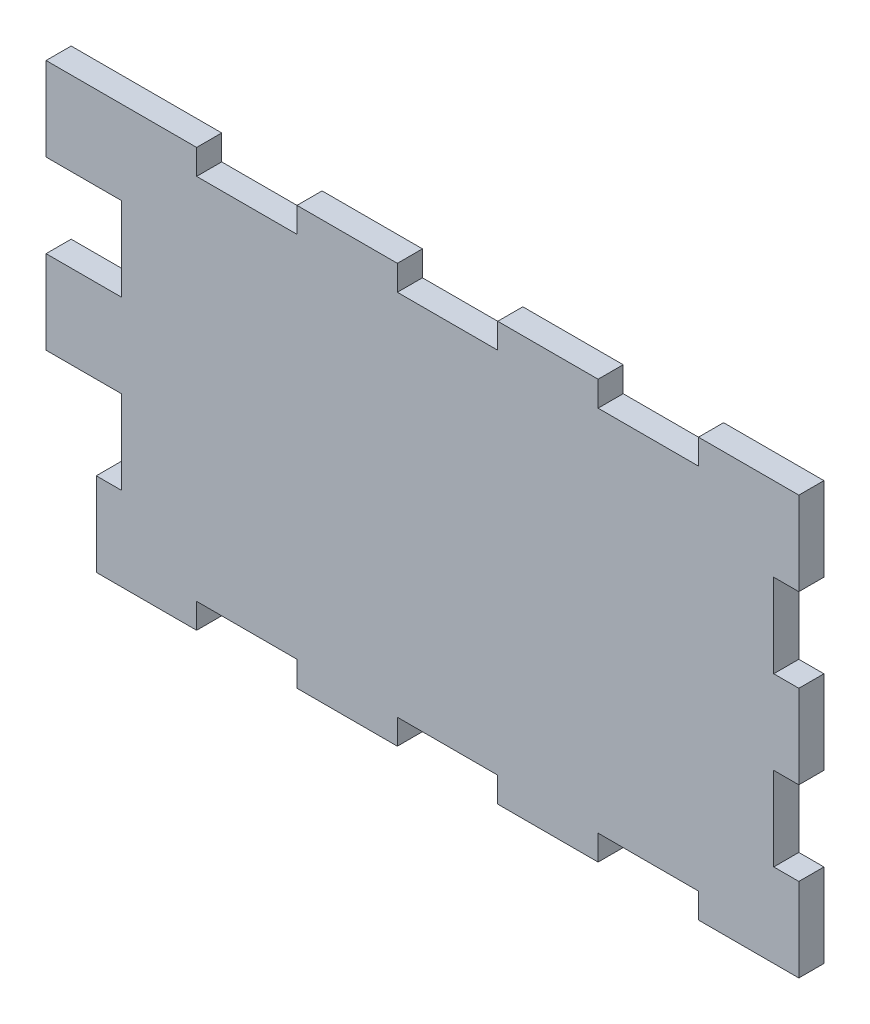
from build123d import *

# Parameters (mm, degrees)
ESBO_O4_W                = 84
ESBO_O4_H                = 50
RESSALTO_EXTRUS_O2_DEPTH = 3
CORTE_EXTRUS_O2_REACH    = 50.969
ESBO_O5_W                = 12
ESBO_O5_H                = 3
CORTE_EXTRUS_O4_REACH    = 50.969
ESBO_O6_W                = 3
ESBO_O6_H                = 10
ESBO_O11_W               = 3
ESBO_O11_H               = 10
RESSALTO_EXTRUS_O4_DEPTH = 6


with BuildPart() as part:
    # Esboço4 → Ressalto-extrusão2 (new body)
    with BuildSketch(Plane.XY):
        Rectangle(ESBO_O4_W, ESBO_O4_H)
    extrude(amount=RESSALTO_EXTRUS_O2_DEPTH)

    # Esboço5 → Corte-extrusão2 (cut, up to next)
    with BuildSketch(Plane.XY.offset(3), mode=Mode.PRIVATE) as corte_extrus_o2_sk1:
        with Locations((24, 23.5)):
            Rectangle(ESBO_O5_W, ESBO_O5_H)
    corte_extrus_o2_tool1 = extrude(corte_extrus_o2_sk1.sketch, amount=-CORTE_EXTRUS_O2_REACH, mode=Mode.PRIVATE) & part.part
    # Esboço5 → Corte-extrusão2 (cut, up to next)
    with BuildSketch(Plane.XY.offset(3), mode=Mode.PRIVATE) as corte_extrus_o2_sk2:
        with Locations((-24, 23.5)):
            Rectangle(ESBO_O5_W, ESBO_O5_H)
    corte_extrus_o2_tool2 = extrude(corte_extrus_o2_sk2.sketch, amount=-CORTE_EXTRUS_O2_REACH, mode=Mode.PRIVATE) & part.part
    # Esboço5 → Corte-extrusão2 (cut, up to next)
    with BuildSketch(Plane.XY.offset(3), mode=Mode.PRIVATE) as corte_extrus_o2_sk3:
        with Locations((0, 23.5)):
            Rectangle(ESBO_O5_W, ESBO_O5_H)
    corte_extrus_o2_tool3 = extrude(corte_extrus_o2_sk3.sketch, amount=-CORTE_EXTRUS_O2_REACH, mode=Mode.PRIVATE) & part.part
    # Esboço5 → Corte-extrusão2 (cut, up to next)
    with BuildSketch(Plane.XY.offset(3), mode=Mode.PRIVATE) as corte_extrus_o2_sk4:
        with Locations((0, -23.5)):
            Rectangle(ESBO_O5_W, ESBO_O5_H)
    corte_extrus_o2_tool4 = extrude(corte_extrus_o2_sk4.sketch, amount=-CORTE_EXTRUS_O2_REACH, mode=Mode.PRIVATE) & part.part
    # Esboço5 → Corte-extrusão2 (cut, up to next)
    with BuildSketch(Plane.XY.offset(3), mode=Mode.PRIVATE) as corte_extrus_o2_sk5:
        with Locations((-24, -23.5)):
            Rectangle(ESBO_O5_W, ESBO_O5_H)
    corte_extrus_o2_tool5 = extrude(corte_extrus_o2_sk5.sketch, amount=-CORTE_EXTRUS_O2_REACH, mode=Mode.PRIVATE) & part.part
    # Esboço5 → Corte-extrusão2 (cut, up to next)
    with BuildSketch(Plane.XY.offset(3), mode=Mode.PRIVATE) as corte_extrus_o2_sk6:
        with Locations((24, -23.5)):
            Rectangle(ESBO_O5_W, ESBO_O5_H)
    corte_extrus_o2_tool6 = extrude(corte_extrus_o2_sk6.sketch, amount=-CORTE_EXTRUS_O2_REACH, mode=Mode.PRIVATE) & part.part
    add(corte_extrus_o2_tool1.solids().sort_by_distance((24, 23.5, 3))[0], mode=Mode.SUBTRACT)
    add(corte_extrus_o2_tool2.solids().sort_by_distance((-24, 23.5, 3))[0], mode=Mode.SUBTRACT)
    add(corte_extrus_o2_tool3.solids().sort_by_distance((0, 23.5, 3))[0], mode=Mode.SUBTRACT)
    add(corte_extrus_o2_tool4.solids().sort_by_distance((0, -23.5, 3))[0], mode=Mode.SUBTRACT)
    add(corte_extrus_o2_tool5.solids().sort_by_distance((-24, -23.5, 3))[0], mode=Mode.SUBTRACT)
    add(corte_extrus_o2_tool6.solids().sort_by_distance((24, -23.5, 3))[0], mode=Mode.SUBTRACT)

    # Esboço6 → Corte-extrusão4 (cut, up to next)
    with BuildSketch(Plane.XY, mode=Mode.PRIVATE) as corte_extrus_o4_sk1:
        with Locations((40.5, 10)):
            Rectangle(ESBO_O6_W, ESBO_O6_H)
    corte_extrus_o4_tool1 = extrude(corte_extrus_o4_sk1.sketch, amount=CORTE_EXTRUS_O4_REACH, mode=Mode.PRIVATE) & part.part
    # Esboço6 → Corte-extrusão4 (cut, up to next)
    with BuildSketch(Plane.XY, mode=Mode.PRIVATE) as corte_extrus_o4_sk2:
        with Locations((-40.5, 10)):
            Rectangle(ESBO_O6_W, ESBO_O6_H)
    corte_extrus_o4_tool2 = extrude(corte_extrus_o4_sk2.sketch, amount=CORTE_EXTRUS_O4_REACH, mode=Mode.PRIVATE) & part.part
    # Esboço6 → Corte-extrusão4 (cut, up to next)
    with BuildSketch(Plane.XY, mode=Mode.PRIVATE) as corte_extrus_o4_sk3:
        with Locations((-40.5, -10)):
            Rectangle(ESBO_O6_W, ESBO_O6_H)
    corte_extrus_o4_tool3 = extrude(corte_extrus_o4_sk3.sketch, amount=CORTE_EXTRUS_O4_REACH, mode=Mode.PRIVATE) & part.part
    # Esboço6 → Corte-extrusão4 (cut, up to next)
    with BuildSketch(Plane.XY, mode=Mode.PRIVATE) as corte_extrus_o4_sk4:
        with Locations((40.5, -10)):
            Rectangle(ESBO_O6_W, ESBO_O6_H)
    corte_extrus_o4_tool4 = extrude(corte_extrus_o4_sk4.sketch, amount=CORTE_EXTRUS_O4_REACH, mode=Mode.PRIVATE) & part.part
    add(corte_extrus_o4_tool1.solids().sort_by_distance((40.5, 10, 0))[0], mode=Mode.SUBTRACT)
    add(corte_extrus_o4_tool2.solids().sort_by_distance((-40.5, 10, 0))[0], mode=Mode.SUBTRACT)
    add(corte_extrus_o4_tool3.solids().sort_by_distance((-40.5, -10, 0))[0], mode=Mode.SUBTRACT)
    add(corte_extrus_o4_tool4.solids().sort_by_distance((40.5, -10, 0))[0], mode=Mode.SUBTRACT)

    # Esboço11 → Ressalto-extrusão4 (add)
    with BuildSketch(Plane.ZY.offset(42)):
        with Locations((1.5, 0)):
            Rectangle(ESBO_O11_W, ESBO_O11_H)
        with Locations((1.5, 20)):
            Rectangle(ESBO_O11_W, ESBO_O11_H)
    extrude(amount=RESSALTO_EXTRUS_O4_DEPTH)


solid = part.part
